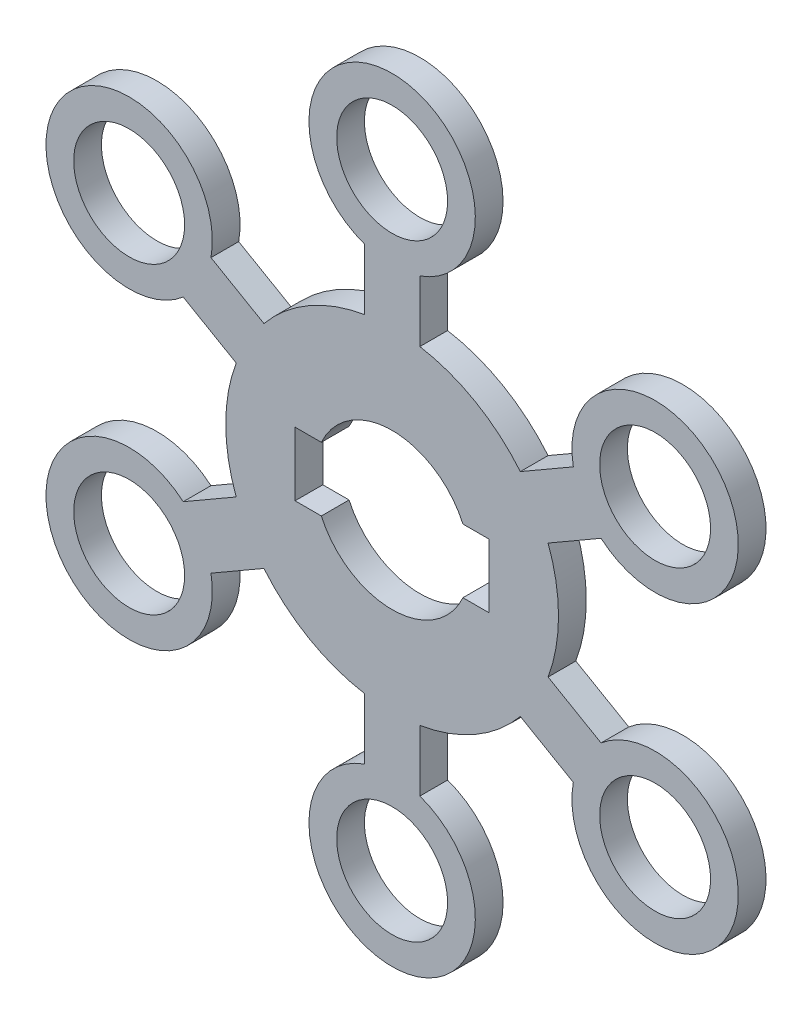
from build123d import *

# Parameters (mm, degrees)
SKETCH1_R           = 20
BOSS_EXTRUDE1_DEPTH = 10


with BuildPart() as part:
    # Sketch1 → Boss-Extrude1 (new body)
    with BuildSketch(Plane.XY):
        with BuildLine():
            Line((56.23475383, -20.920144878), (75.334884287, -31.947610338))
            ThreePointArc((75.334884287, -31.947610338), (120.810543828, -69.75), (65.334884287, -49.268118414))
            Line((65.334884287, -49.268118414), (46.23475383, -38.240652953))
            ThreePointArc((46.23475383, -38.240652953), (30, -51.961524227), (10, -59.160797831))
            Line((10, -59.160797831), (10, -81.215728753))
            ThreePointArc((10, -81.215728753), (0, -139.5), (-10, -81.215728753))
            Line((-10, -81.215728753), (-10, -59.160797831))
            ThreePointArc((-10, -59.160797831), (-30, -51.961524227), (-46.23475383, -38.240652953))
            Line((-46.23475383, -38.240652953), (-65.334884287, -49.268118414))
            ThreePointArc((-65.334884287, -49.268118414), (-120.810543828, -69.75), (-75.334884287, -31.947610338))
            Line((-75.334884287, -31.947610338), (-56.23475383, -20.920144878))
            ThreePointArc((-56.23475383, -20.920144878), (-60, 0), (-56.23475383, 20.920144878))
            Line((-56.23475383, 20.920144878), (-75.334884287, 31.947610338))
            ThreePointArc((-75.334884287, 31.947610338), (-120.810543828, 69.75), (-65.334884287, 49.268118414))
            Line((-65.334884287, 49.268118414), (-46.23475383, 38.240652953))
            ThreePointArc((-46.23475383, 38.240652953), (-30, 51.961524227), (-10, 59.160797831))
            Line((-10, 59.160797831), (-10, 81.215728753))
            ThreePointArc((-10, 81.215728753), (0, 139.5), (10, 81.215728753))
            Line((10, 81.215728753), (10, 59.160797831))
            ThreePointArc((10, 59.160797831), (30, 51.961524227), (46.23475383, 38.240652953))
            Line((46.23475383, 38.240652953), (65.334884287, 49.268118414))
            ThreePointArc((65.334884287, 49.268118414), (120.810543828, 69.75), (75.334884287, 31.947610338))
            Line((75.334884287, 31.947610338), (56.23475383, 20.920144878))
            ThreePointArc((56.23475383, 20.920144878), (60, 0), (56.23475383, -20.920144878))
        make_face()
        with Locations((94.829781714, 54.75)):
            Circle(SKETCH1_R, mode=Mode.SUBTRACT)
        with Locations((94.829781714, -54.75)):
            Circle(SKETCH1_R, mode=Mode.SUBTRACT)
        with Locations((0, -109.5)):
            Circle(SKETCH1_R, mode=Mode.SUBTRACT)
        with Locations((-94.829781714, -54.75)):
            Circle(SKETCH1_R, mode=Mode.SUBTRACT)
        with Locations((-94.829781714, 54.75)):
            Circle(SKETCH1_R, mode=Mode.SUBTRACT)
        with Locations((0, 109.5)):
            Circle(SKETCH1_R, mode=Mode.SUBTRACT)
        with BuildLine():
            ThreePointArc((25.529394822, 11.5), (0, 28), (-25.529394822, 11.5))
            Line((-25.529394822, 11.5), (-35, 11.5))
            Line((-35, 11.5), (-35, -11.5))
            Line((-35, -11.5), (-25.529394822, -11.5))
            ThreePointArc((-25.529394822, -11.5), (0, -28), (25.529394822, -11.5))
            Line((25.529394822, -11.5), (35, -11.5))
            Line((35, -11.5), (35, 11.5))
            Line((35, 11.5), (25.529394822, 11.5))
        make_face(mode=Mode.SUBTRACT)
    extrude(amount=BOSS_EXTRUDE1_DEPTH)


solid = part.part
